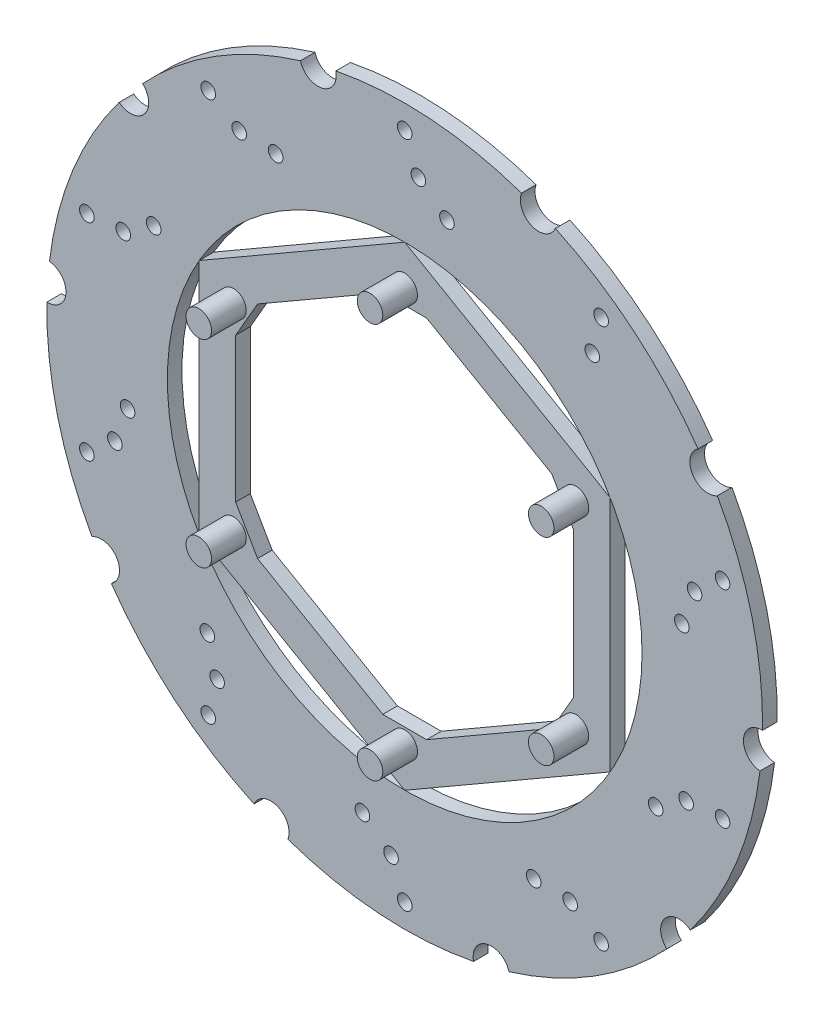
from build123d import *

# Parameters (mm, degrees)
SKETCH1_R           = 98
SKETCH1_R_2         = 65
BOSS_EXTRUDE1_DEPTH = 4
SKETCH2_R           = 2
CUT_EXTRUDE1_DEPTH  = 14
CUT_EXTRUDE2_DEPTH  = 4
BOSS_EXTRUDE3_DEPTH = 4
SKETCH7_R           = 3.5
BOSS_EXTRUDE4_DEPTH = 9.5


with BuildPart() as part:
    # Sketch1 → Boss-Extrude1 (new body)
    with BuildSketch(Plane.XY):
        Circle(SKETCH1_R)
        Circle(SKETCH1_R_2, mode=Mode.SUBTRACT)
    extrude(amount=BOSS_EXTRUDE1_DEPTH)

    # Sketch2 → Cut-Extrude1 (cut)
    with BuildSketch(Plane.XY.offset(4)):
        with Locations((0, 91.526608606)):
            Circle(SKETCH2_R)
        with Locations((11.574594434, 76.038220279)):
            Circle(SKETCH2_R)
        with Locations((3.739617643, 82.252167389)):
            Circle(SKETCH2_R)
        with Locations((53.797990731, 74.0465818)):
            Circle(SKETCH2_R)
        with Locations((51.372025186, 64.345309143)):
            Circle(SKETCH2_R)
        with Locations((87.046977529, 28.283277497)):
            Circle(SKETCH2_R)
        with Locations((79.382065179, 21.86072982)):
            Circle(SKETCH2_R)
        with Locations((75.893391267, 12.489008829)):
            Circle(SKETCH2_R)
        with Locations((87.046977529, -28.283277497)):
            Circle(SKETCH2_R)
        with Locations((77.070854371, -28.973905275)):
            Circle(SKETCH2_R)
        with Locations((68.739898501, -34.505195748)):
            Circle(SKETCH2_R)
        with Locations((53.797990731, -74.0465818)):
            Circle(SKETCH2_R)
        with Locations((45.321196735, -68.741493342)):
            Circle(SKETCH2_R)
        with Locations((35.330100891, -68.319588337)):
            Circle(SKETCH2_R)
        with Locations((0, -91.526608606)):
            Circle(SKETCH2_R)
        with Locations((-3.739617643, -82.252167389)):
            Circle(SKETCH2_R)
        with Locations((-11.574594434, -76.038220279)):
            Circle(SKETCH2_R)
        with Locations((-53.797990731, -74.0465818)):
            Circle(SKETCH2_R)
        with Locations((-51.372025186, -64.345309143)):
            Circle(SKETCH2_R)
        with Locations((-54.058188091, -54.712836519)):
            Circle(SKETCH2_R)
        with Locations((-87.046977529, -28.283277497)):
            Circle(SKETCH2_R)
        with Locations((-79.382065179, -21.86072982)):
            Circle(SKETCH2_R)
        with Locations((-75.893391267, -12.489008829)):
            Circle(SKETCH2_R)
        with Locations((-87.046977529, 28.283277497)):
            Circle(SKETCH2_R)
        with Locations((-77.070854371, 28.973905275)):
            Circle(SKETCH2_R)
        with Locations((-68.739898501, 34.505195748)):
            Circle(SKETCH2_R)
        with Locations((-53.797990731, 74.0465818)):
            Circle(SKETCH2_R)
        with Locations((-45.321196735, 68.741493342)):
            Circle(SKETCH2_R)
        with Locations((-35.330100891, 68.319588337)):
            Circle(SKETCH2_R)
    extrude(amount=-CUT_EXTRUDE1_DEPTH, mode=Mode.SUBTRACT)

    # Sketch3 → Cut-Extrude2 (cut)
    with BuildSketch(Plane.XY.offset(4)):
        with BuildLine():
            Line((32.148814638, 92.998282907), (41.385007572, 89.194391172))
            ThreePointArc((41.385007572, 89.194391172), (34.772894087, 86.254683496), (32.148814638, 92.998282907))
        make_face()
        with BuildLine():
            Line((80.671956573, 56.340592196), (85.908322156, 47.834281145))
            ThreePointArc((85.908322156, 47.834281145), (78.83109316, 49.342510469), (80.671956573, 56.340592196))
        make_face()
        with BuildLine():
            Line((98.381153035, -1.837289787), (97.617577593, -11.796898453))
            ThreePointArc((97.617577593, -11.796898453), (92.778494017, -6.416824467), (98.381153035, -1.837289787))
        make_face()
        with BuildLine():
            Line((78.51209289, -59.313389519), (72.040236289, -66.922063803))
            ThreePointArc((72.040236289, -66.922063803), (71.287663584, -59.725150556), (78.51209289, -59.313389519))
        make_face()
        with BuildLine():
            Line((28.65408179, -94.133790442), (18.94597328, -96.485275378))
            ThreePointArc((18.94597328, -96.485275378), (22.567368641, -90.220499117), (28.65408179, -94.133790442))
        make_face()
        with BuildLine():
            Line((-32.148814638, -92.998282907), (-41.385007572, -89.194391172))
            ThreePointArc((-41.385007572, -89.194391172), (-34.772894087, -86.254683496), (-32.148814638, -92.998282907))
        make_face()
        with BuildLine():
            Line((-80.671956573, -56.340592196), (-85.908322156, -47.834281145))
            ThreePointArc((-85.908322156, -47.834281145), (-78.83109316, -49.342510469), (-80.671956573, -56.340592196))
        make_face()
        with BuildLine():
            Line((-98.381153035, 1.837289787), (-97.617577593, 11.796898453))
            ThreePointArc((-97.617577593, 11.796898453), (-92.778494017, 6.416824467), (-98.381153035, 1.837289787))
        make_face()
        with BuildLine():
            Line((-78.51209289, 59.313389519), (-72.040236289, 66.922063803))
            ThreePointArc((-72.040236289, 66.922063803), (-71.287663584, 59.725150556), (-78.51209289, 59.313389519))
        make_face()
        with BuildLine():
            Line((-28.65408179, 94.133790442), (-18.94597328, 96.485275378))
            ThreePointArc((-18.94597328, 96.485275378), (-22.567368641, 90.220499117), (-28.65408179, 94.133790442))
        make_face()
    extrude(amount=-CUT_EXTRUDE2_DEPTH, mode=Mode.SUBTRACT)


with BuildPart() as body_2:
    # Sketch6 → Boss-Extrude3 (new body)
    with BuildSketch(Plane.XY):
        Polygon((56.291651246, -32.5), (56.291651246, 32.5), (0, 65), (-56.291651246, 32.5), (-56.291651246, -32.5), (0, -65), align=None)
        Polygon((40.291651246, 30.190598923), (46.291651246, 19.798294078), (46.291651246, -19.798294078), (40.291651246, -30.190598923), (6, -49.988893001), (-6, -49.988893001), (-40.291651246, -30.190598923), (-46.291651246, -19.798294078), (-46.291651246, 19.798294078), (-40.291651246, 30.190598923), (-6, 49.988893001), (6, 49.988893001), align=None, mode=Mode.SUBTRACT)
    extrude(amount=BOSS_EXTRUDE3_DEPTH)

    # Sketch7 → Boss-Extrude4 (add)
    with BuildSketch(Plane.XY.offset(4)):
        with Locations((-46.888532128, 27.071106646)):
            Circle(SKETCH7_R)
        with Locations((0, 54.142213292)):
            Circle(SKETCH7_R)
        with Locations((46.888532128, 27.071106646)):
            Circle(SKETCH7_R)
        with Locations((46.888532128, -27.071106646)):
            Circle(SKETCH7_R)
        with Locations((0, -54.142213292)):
            Circle(SKETCH7_R)
        with Locations((-46.888532128, -27.071106646)):
            Circle(SKETCH7_R)
    extrude(amount=BOSS_EXTRUDE4_DEPTH)


solid = Compound([part.part, body_2.part])
